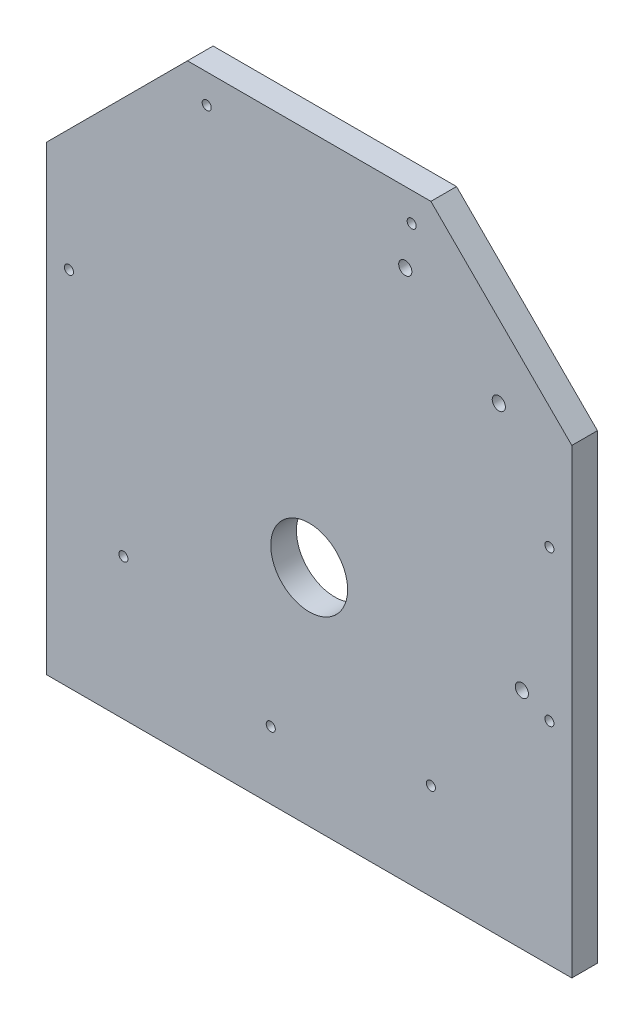
from build123d import *

# Parameters (mm, degrees)
BOSS_EXTRUDE1_DEPTH         = 12.7
SKETCH2_R                   = 19.05
CUT_EXTRUDE1_DEPTH          = 214.127417875
F_16_0_177_DIAMETER_HOLE1_D = 4.4958
F_0_257_DIAMETER_HOLE1_D    = 6.5278


with BuildPart() as part:
    # Sketch1 → Boss-Extrude1 (new body)
    with BuildSketch(Plane.XY):
        Polygon((-130.175, -168.275), (130.175, -168.275), (130.175, 60.325), (60.325, 130.175), (-60.325, 130.175), (-130.175, 60.325), align=None)
    extrude(amount=BOSS_EXTRUDE1_DEPTH)

    # Sketch2 → Cut-Extrude1 (cut, through all)
    with BuildSketch(Plane.XY):
        with Locations((0, -57.15)):
            Circle(SKETCH2_R)
    extrude(amount=CUT_EXTRUDE1_DEPTH, mode=Mode.SUBTRACT)

    # #16 (0.177) Diameter Hole1 (through all)
    with Locations(Plane.XY.offset(12.7)):
        with Locations((-50.8, 115.9002), (50.8, 115.9002), (119.0752, 11.1252), (119.0752, -63.5), (60.325, -120.65), (-19.05, -134.9375), (-92.075, -98.425), (-119.0752, 11.1252)):
            Hole(F_16_0_177_DIAMETER_HOLE1_D / 2)

    # F (0.257) Diameter Hole1 (through all)
    with Locations(Plane(origin=(0, 0, 0), x_dir=(-1, 0, 0), z_dir=(0, 0, -1))):
        with Locations((-105.41, -57.15), (-93.98, 60.325), (-47.625, 95.25)):
            Hole(F_0_257_DIAMETER_HOLE1_D / 2)


solid = part.part
